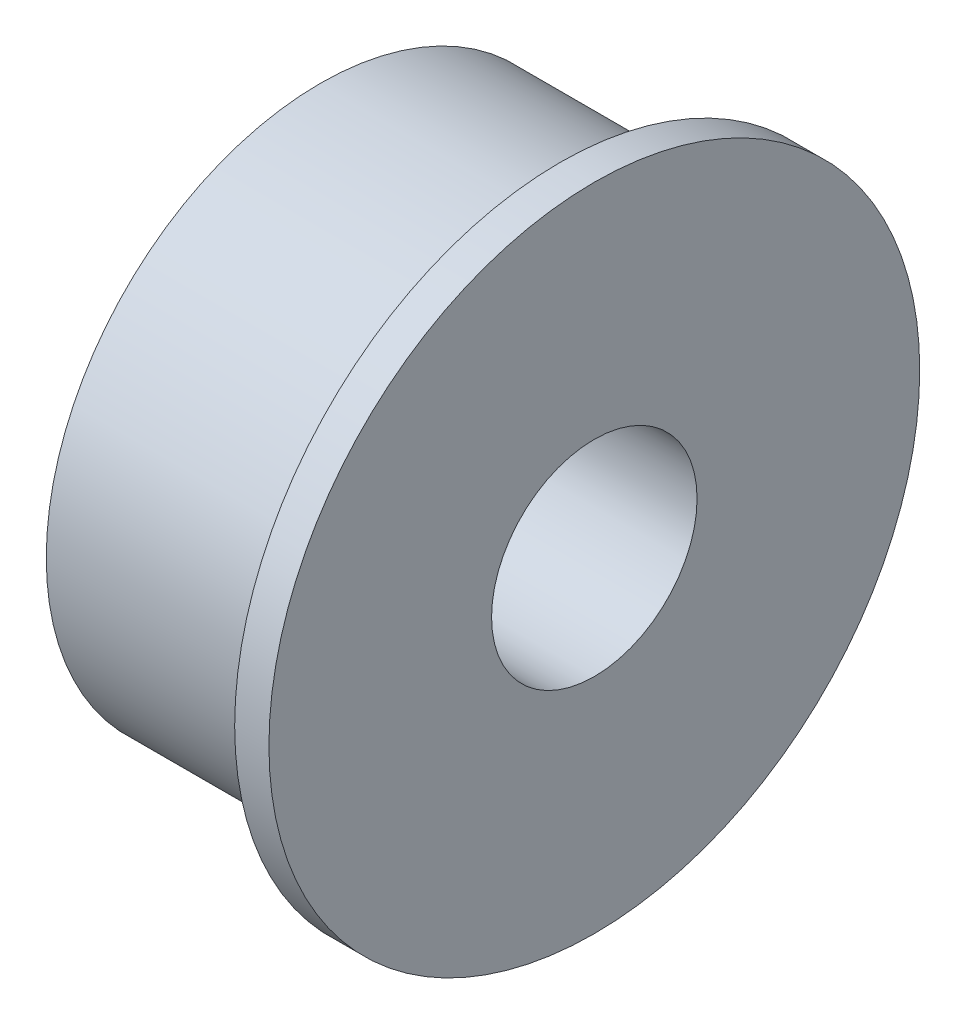
from build123d import *


with BuildPart() as part:
    # Sketch1 → Revolve1 (revolve)
    with BuildSketch(Plane.XY, mode=Mode.PRIVATE) as revolve1_sk:
        Polygon((0, 1.5), (4, 1.5), (4, 4.75), (3.5, 4.75), (3.5, 4), (0, 4), align=None)
    revolve(revolve1_sk.sketch.rotate(Axis((0, 0, 0), (1, 0, 0)), 90), axis=Axis((0, 0, 0), (1, 0, 0)))


solid = part.part
